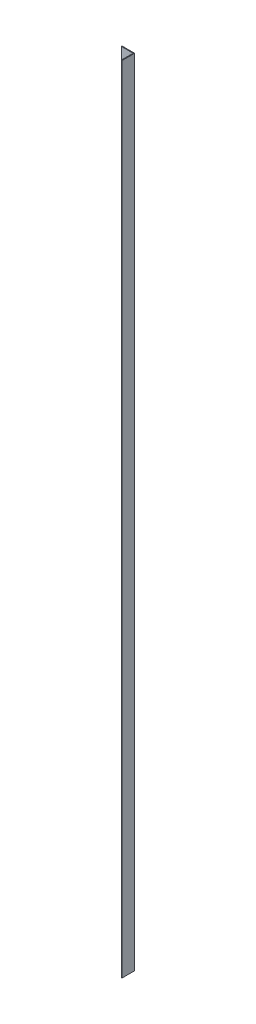
from build123d import *

# Parameters (mm, degrees)
BOSS_EXTRUDE1_DEPTH = 825


with BuildPart() as part:
    # Sketch2 → Boss-Extrude1 (new, symmetric)
    with BuildSketch(Plane.XZ.offset(750)):
        Polygon((275, 169.5), (273.5, 169.5), (273.5, 145), (249, 145), (249, 143.5), (275, 143.5), align=None)
    extrude(amount=BOSS_EXTRUDE1_DEPTH, both=True)


solid = part.part
